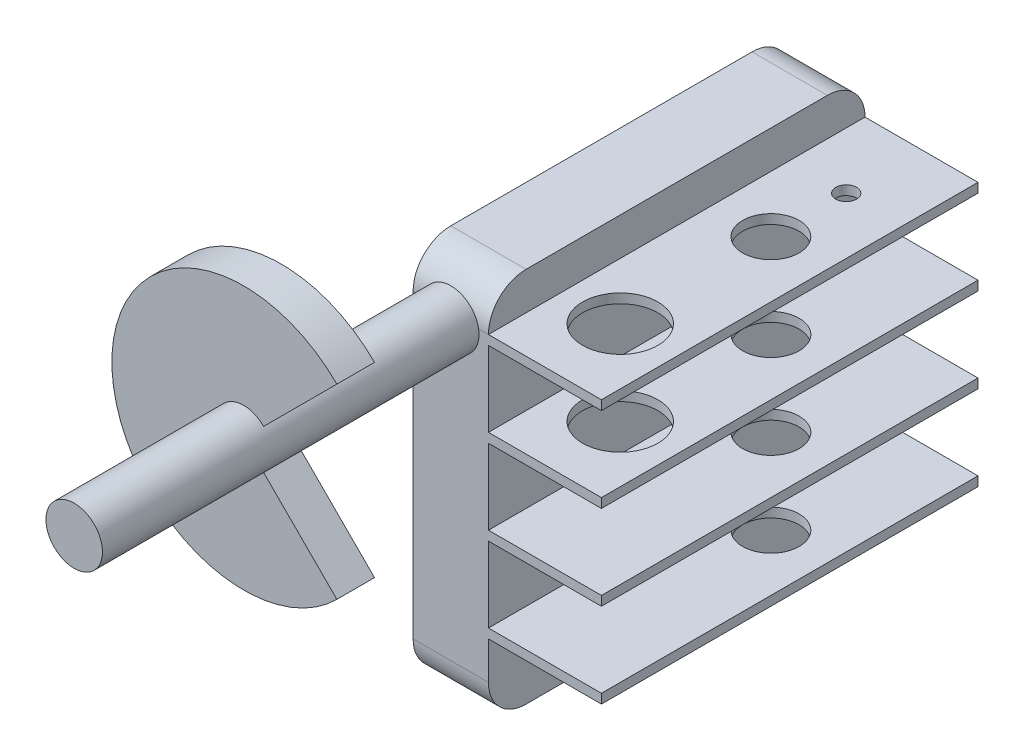
from build123d import *

# Parameters (mm, degrees)
BOSS_EXTRUDE1_DEPTH              = 10
FILLET1_R                        = 1
SKETCH2_R                        = 0.75
BOSS_EXTRUDE2_DEPTH              = 10
BOSS_EXTRUDE3_DEPTH              = 1
F_0_55_0_55_DIAMETER_HOLE1_D     = 0.55
F_0_55_0_55_DIAMETER_HOLE1_DEPTH = 0.25
F_1_5_1_5_DIAMETER_HOLE1_D       = 1.5
F_2_0MM_DOWEL_HOLE1_D            = 2
F_2_0MM_DOWEL_HOLE1_DEPTH        = 4.499


with BuildPart() as part:
    # Sketch1 → Boss-Extrude1 (new body)
    with BuildSketch(Plane.XY):
        Polygon((0, 0), (0, 10), (2, 10), (2, 9), (5, 9), (5, 8.75), (2, 8.75), (2, 6.75), (5, 6.75), (5, 6.5), (2, 6.5), (2, 4.5), (5, 4.5), (5, 4.25), (2, 4.25), (2, 2.25), (5, 2.25), (5, 2), (2, 2), (2, 0), align=None)
    extrude(amount=BOSS_EXTRUDE1_DEPTH)

    # Fillet1
    fillet1_edges = [part.edges().sort_by_distance(p)[0] for p in [
        (1, 10, 0),
        (1, 0, 0),
        (1, 0, 10),
        (1, 10, 10),
    ]]
    fillet(fillet1_edges, radius=FILLET1_R)

    # Sketch2 → Boss-Extrude2 (add)
    with BuildSketch(Plane.XY.offset(10)):
        with Locations(Location((1, 8.871498734, 0), (0, 0, 170.134550894))):
            Circle(SKETCH2_R)
    extrude(amount=BOSS_EXTRUDE2_DEPTH)

    # Sketch3 → Boss-Extrude3 (add)
    with BuildSketch(Plane.XY.offset(14.5)):
        with BuildLine():
            Line((1, 8.871498734), (3.474873734, 11.346372468))
            ThreePointArc((3.474873734, 11.346372468), (-2.5, 8.871498734), (3.474873734, 6.396625))
            Line((3.474873734, 6.396625), (1, 8.871498734))
        make_face()
    extrude(amount=BOSS_EXTRUDE3_DEPTH)

    # Ø0.55 (0.55) Diameter Hole1
    with Locations(Plane(origin=(3.5, 9, 2), x_dir=(0, 0, 1), z_dir=(0, 1, 0))):
        with Locations((0, 0)):
            Hole(F_0_55_0_55_DIAMETER_HOLE1_D / 2, depth=F_0_55_0_55_DIAMETER_HOLE1_DEPTH)

    # Ø1.5 (1.5) Diameter Hole1 (through all)
    with Locations(Plane(origin=(0, 9, 0), x_dir=(1, 0, 0), z_dir=(0, 1, 0))):
        with Locations((3.5, -4)):
            Hole(F_1_5_1_5_DIAMETER_HOLE1_D / 2)

    # Ø2.0mm Dowel Hole1
    with Locations(Plane(origin=(0, 9, 0), x_dir=(1, 0, 0), z_dir=(0, 1, 0))):
        with Locations((3.5, -8)):
            Hole(F_2_0MM_DOWEL_HOLE1_D / 2, depth=F_2_0MM_DOWEL_HOLE1_DEPTH)


solid = part.part
